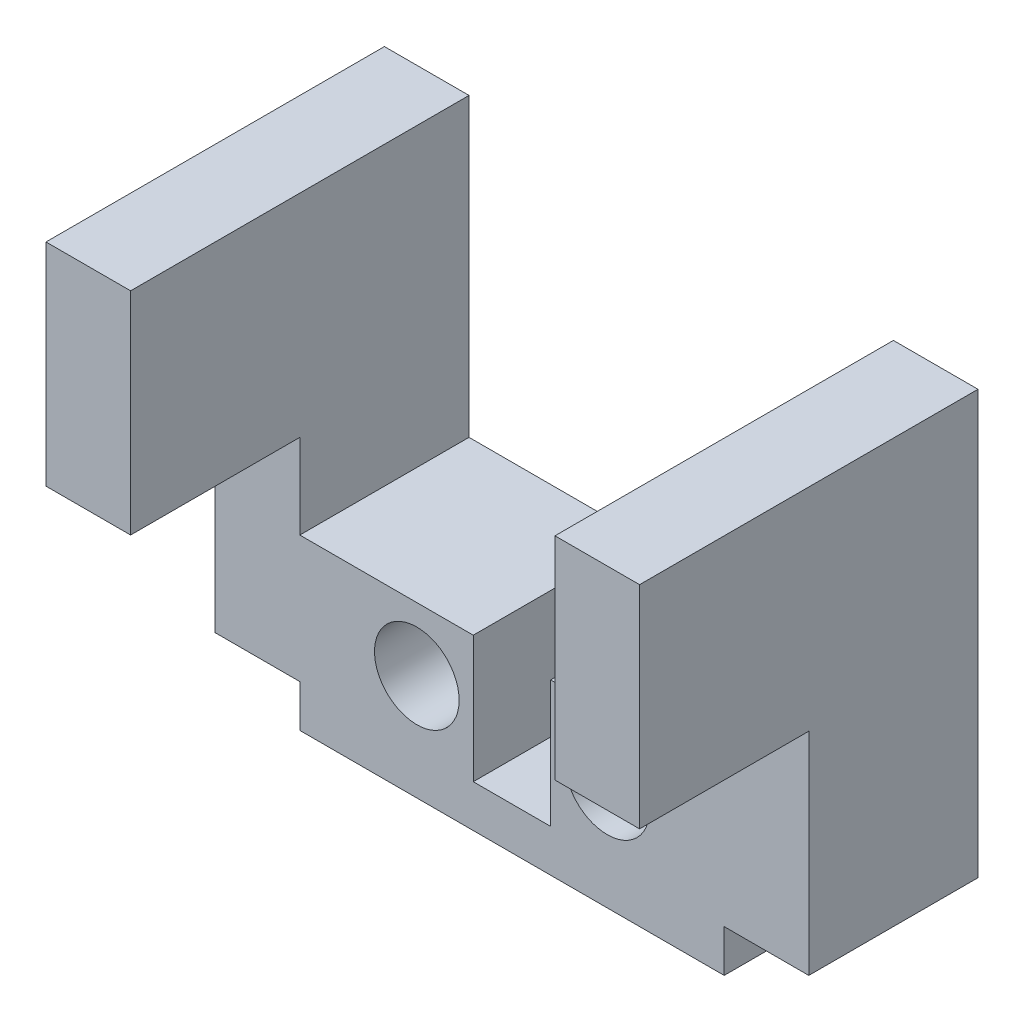
from build123d import *

# Parameters (mm, degrees)
SKETCH_1_R      = 2
EXTRUDE_1_DEPTH = 8
SKETCH_2_W      = 4
SKETCH_2_H      = 10
EXTRUDE_2_DEPTH = 8


with BuildPart() as part:
    # 草图1 → 凸台-拉伸1 (new body)
    with BuildSketch(Plane.XY):
        Polygon((-1.831289914, -3), (-1.831289914, 3), (-10.031289914, 3), (-10.031289914, 17), (-14.031289914, 17), (-14.031289914, -3), (-10.031289914, -3), (-10.031289914, -5), (10.031289914, -5), (10.031289914, -3), (14.031289914, -3), (14.031289914, 17), (10.031289914, 17), (10.031289914, 3), (1.831289914, 3), (1.831289914, -3), align=None)
        with Locations((-4.5, 0)):
            Circle(SKETCH_1_R, mode=Mode.SUBTRACT)
        with Locations(Location((4.5, 0, 0), (0, 0, 180))):
            Circle(SKETCH_1_R, mode=Mode.SUBTRACT)
    extrude(amount=EXTRUDE_1_DEPTH)

    # 草图2 → 凸台-拉伸2 (add)
    with BuildSketch(Plane.XY.offset(8)):
        with Locations((-12.031289914, 12)):
            Rectangle(SKETCH_2_W, SKETCH_2_H)
        with Locations((12.031289914, 12)):
            Rectangle(SKETCH_2_W, SKETCH_2_H)
    extrude(amount=EXTRUDE_2_DEPTH)


solid = part.part
